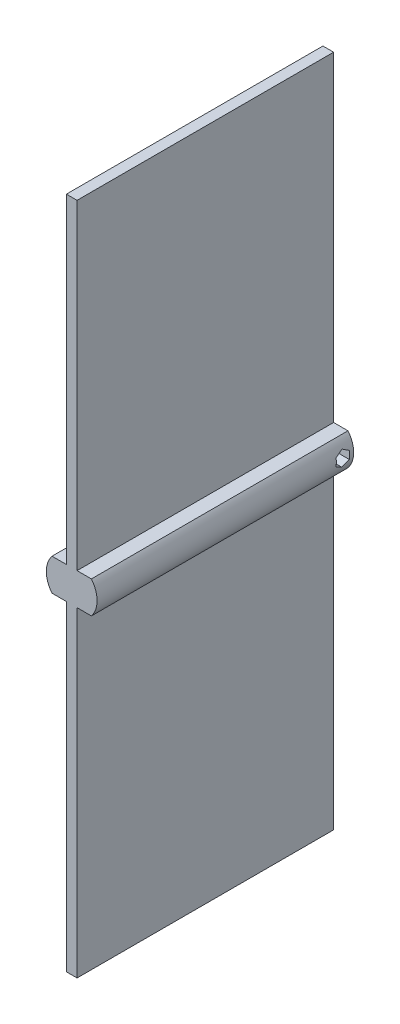
from build123d import *

# Parameters (mm, degrees)
SKETCH1_R           = 4.75
BOSS_EXTRUDE1_DEPTH = 48
CUT_EXTRUDE1_DEPTH  = 10
CUT_EXTRUDE2_DEPTH  = 49.568905691
CUT_EXTRUDE3_REACH  = 50.468
SKETCH5_W           = 2
SKETCH5_H           = 48
BOSS_EXTRUDE2_DEPTH = 60


with BuildPart() as part:
    # Sketch1 → Boss-Extrude1 (new body)
    with BuildSketch(Plane.XY):
        Circle(SKETCH1_R)
    extrude(amount=BOSS_EXTRUDE1_DEPTH)

    # Sketch2 → Cut-Extrude1 (cut)
    with BuildSketch(Plane(origin=(0, 0, 0), x_dir=(-1, 0, 0), z_dir=(0, 0, -1))):
        with BuildLine():
            Line((-0.94, 1.535057002), (-0.94, -1.535057002))
            ThreePointArc((-0.94, -1.535057002), (1.8, 0), (-0.94, 1.535057002))
        make_face()
    extrude(amount=-CUT_EXTRUDE1_DEPTH, mode=Mode.SUBTRACT)

    # Sketch3 → Cut-Extrude2 (cut, through all)
    with BuildSketch(Plane.ZY.offset(-0.94)):
        Polygon((3.230708553, 0.754115238), (1.962271323, 1.44288249), (0.73156277, 0.688767252), (0.769291447, -0.754115238), (2.037728677, -1.44288249), (3.26843723, -0.688767252), align=None)
    extrude(amount=-CUT_EXTRUDE2_DEPTH, mode=Mode.SUBTRACT)

    # Sketch4 → Cut-Extrude3 (cut, up to next)
    with BuildSketch(Plane(origin=(0, 0, 0), x_dir=(-1, 0, 0), z_dir=(0, 0, -1)), mode=Mode.PRIVATE) as cut_extrude3_sk1:
        with BuildLine():
            Line((-3.682729966, 3), (3.682729966, 3))
            ThreePointArc((3.682729966, 3), (0, 4.75), (-3.682729966, 3))
        make_face()
    cut_extrude3_tool1 = extrude(cut_extrude3_sk1.sketch, amount=-CUT_EXTRUDE3_REACH, mode=Mode.PRIVATE) & part.part
    # Sketch4 → Cut-Extrude3 (cut, up to next)
    with BuildSketch(Plane(origin=(0, 0, 0), x_dir=(-1, 0, 0), z_dir=(0, 0, -1)), mode=Mode.PRIVATE) as cut_extrude3_sk2:
        with BuildLine():
            Line((-3.682729966, -3), (3.682729966, -3))
            ThreePointArc((3.682729966, -3), (0, -4.75), (-3.682729966, -3))
        make_face()
    cut_extrude3_tool2 = extrude(cut_extrude3_sk2.sketch, amount=-CUT_EXTRUDE3_REACH, mode=Mode.PRIVATE) & part.part
    add(cut_extrude3_tool1.solids().sort_by_distance((0, 3.712383, 0))[0], mode=Mode.SUBTRACT)
    add(cut_extrude3_tool2.solids().sort_by_distance((0, -3.712383, 0))[0], mode=Mode.SUBTRACT)

    # Sketch5 → Boss-Extrude2 (add)
    with BuildSketch(Plane(origin=(0, 3, 0), x_dir=(1, 0, 0), z_dir=(0, 1, 0))):
        with Locations((0, -24)):
            Rectangle(SKETCH5_W, SKETCH5_H)
    boss_extrude2 = extrude(amount=BOSS_EXTRUDE2_DEPTH)

    # Mirror2: Boss-Extrude2 across plane
    add(boss_extrude2.mirror(Plane.ZX))


solid = part.part
